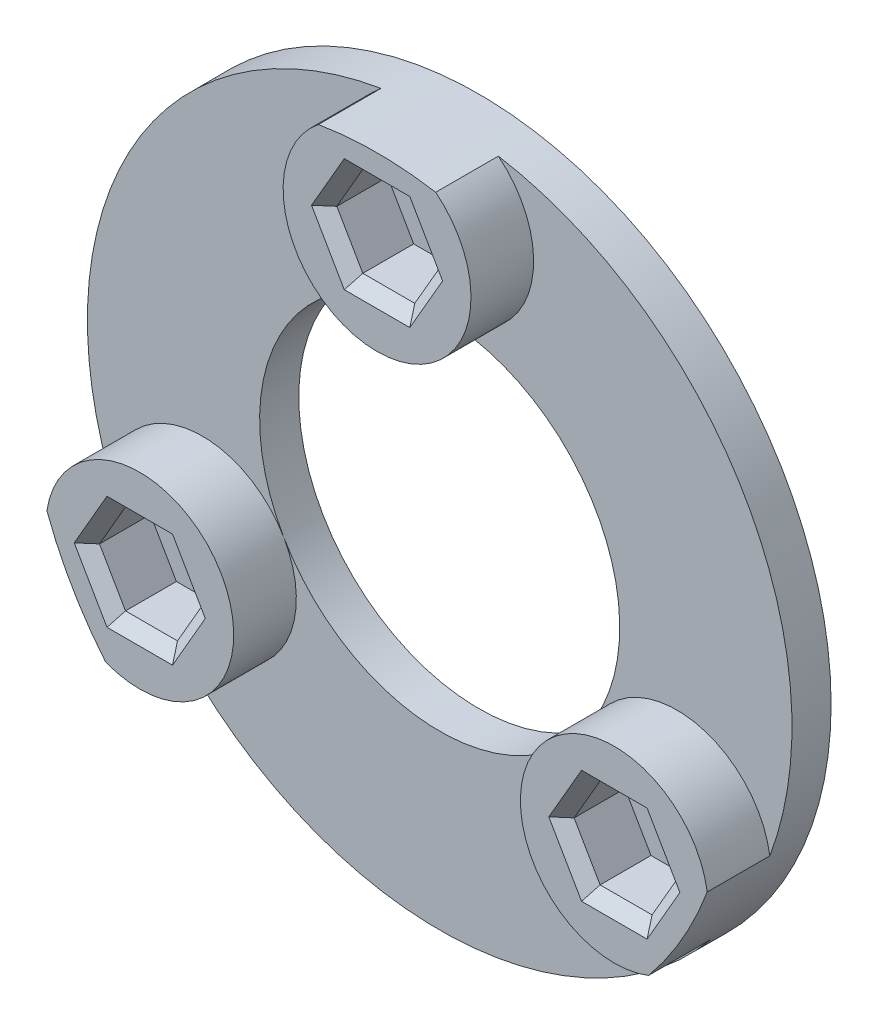
from build123d import *

# Parameters (mm, degrees)
SKETCH1_R           = 22.5
SKETCH1_R_2         = 11.5
SKETCH1_R_3         = 1.65
BOSS_EXTRUDE1_DEPTH = 2.5
BOSS_EXTRUDE2_DEPTH = 4
CHAMFER1_SIZE       = 0.75


with BuildPart() as part:
    # Sketch1 → Boss-Extrude1 (new body)
    with BuildSketch(Plane.XY):
        Circle(SKETCH1_R)
        Circle(SKETCH1_R_2, mode=Mode.SUBTRACT)
        with Locations((0, 17.5)):
            Circle(SKETCH1_R_3, mode=Mode.SUBTRACT)
        with Locations((15.155444566, -8.75)):
            Circle(SKETCH1_R_3, mode=Mode.SUBTRACT)
        with Locations((-15.155444566, -8.75)):
            Circle(SKETCH1_R_3, mode=Mode.SUBTRACT)
    extrude(amount=BOSS_EXTRUDE1_DEPTH)

    # Sketch2 → Boss-Extrude2 (add)
    # profile 1 of 3: a face of its own
    with BuildSketch(Plane.XY.offset(2.5)):
        with BuildLine():
            ThreePointArc((3.747543413, 22.185714286), (0, 22.5), (-3.747543413, 22.185714286))
            ThreePointArc((-3.747543413, 22.185714286), (0, 11.5), (3.747543413, 22.185714286))
        make_face()
        Polygon((1.659882024, 20.375), (3.319764048, 17.5), (1.659882024, 14.625), (-1.659882024, 14.625), (-3.319764048, 17.5), (-1.659882024, 20.375), align=None, mode=Mode.SUBTRACT)
    # profile 2 of 3: a face of its own
    with BuildSketch(Plane.XY.offset(2.5)):
        with BuildLine():
            ThreePointArc((-17.339620466, -14.33832494), (-9.959292144, -5.75), (-21.087163879, -7.847389345))
            ThreePointArc((-21.087163879, -7.847389345), (-19.485571585, -11.25), (-17.339620466, -14.33832494))
        make_face()
        Polygon((-18.475208614, -8.75), (-16.81532659, -5.875), (-13.495562542, -5.875), (-11.835680518, -8.75), (-13.495562542, -11.625), (-16.81532659, -11.625), align=None, mode=Mode.SUBTRACT)
    # profile 3 of 3: a face of its own
    with BuildSketch(Plane.XY.offset(2.5)):
        with BuildLine():
            ThreePointArc((17.339620466, -14.33832494), (19.485571585, -11.25), (21.087163879, -7.847389345))
            ThreePointArc((21.087163879, -7.847389345), (9.959292144, -5.75), (17.339620466, -14.33832494))
        make_face()
        Polygon((16.81532659, -11.625), (13.495562542, -11.625), (11.835680518, -8.75), (13.495562542, -5.875), (16.81532659, -5.875), (18.475208614, -8.75), align=None, mode=Mode.SUBTRACT)
    extrude(amount=BOSS_EXTRUDE2_DEPTH)

    # Chamfer1
    chamfer1_edges = [part.edges().sort_by_distance(p)[0] for p in [
        (2.489823036, 16.0625, 6.5),
        (0, 14.625, 6.5),
        (-2.489823036, 16.0625, 6.5),
        (-2.489823036, 18.9375, 6.5),
        (0, 20.375, 6.5),
        (2.489823036, 18.9375, 6.5),
        (-15.155444566, -5.875, 6.5),
        (-12.66562153, -7.3125, 6.5),
        (-12.66562153, -10.1875, 6.5),
        (-15.155444566, -11.625, 6.5),
        (-17.645267602, -10.1875, 6.5),
        (-17.645267602, -7.3125, 6.5),
        (12.66562153, -10.1875, 6.5),
        (12.66562153, -7.3125, 6.5),
        (15.155444566, -5.875, 6.5),
        (17.645267602, -7.3125, 6.5),
        (17.645267602, -10.1875, 6.5),
        (15.155444566, -11.625, 6.5),
    ]]
    chamfer(chamfer1_edges, length=CHAMFER1_SIZE)


solid = part.part
